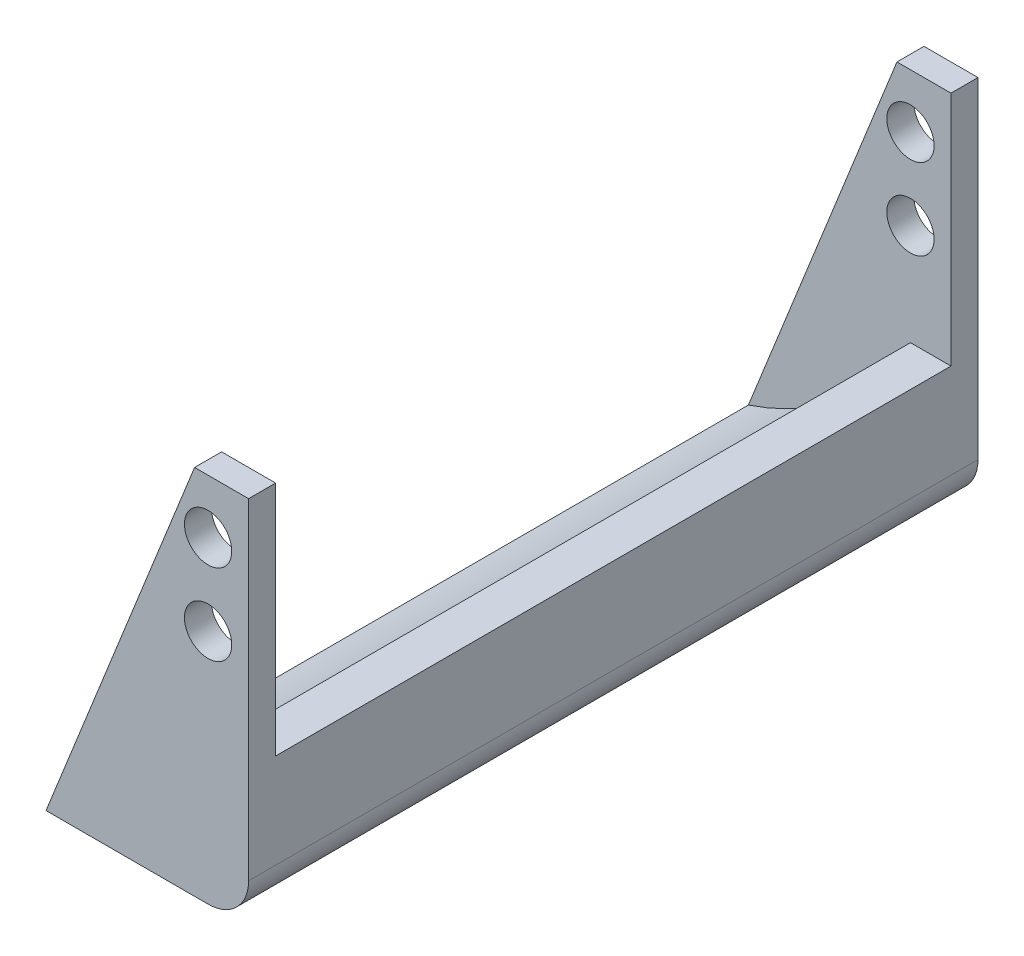
from build123d import *

# Parameters (mm, degrees)
BOSS_EXTRUDE1_DEPTH = 25
SKETCH2_R           = 1.75
BOSS_EXTRUDE2_DEPTH = 2
FILLET1_R           = 3


with BuildPart() as part:
    # Sketch1 → Boss-Extrude1 (new, symmetric)
    with BuildSketch(Plane.XY):
        with BuildLine():
            Line((0, 0), (15, 0))
            Line((15, 0), (15, 10))
            Line((15, 10), (12, 10))
            ThreePointArc((12, 10), (6.940286442, 3.871656269), (0, 0))
        make_face()
    extrude(amount=BOSS_EXTRUDE1_DEPTH, both=True)

    # Sketch2 → Boss-Extrude2 (add)
    with BuildSketch(Plane.XY.offset(25)):
        Polygon((15, 0), (15, 27.5), (11, 27.5), (0, 0), align=None)
        with Locations((12, 23.5)):
            Circle(SKETCH2_R, mode=Mode.SUBTRACT)
        with Locations((12, 17.5)):
            Circle(SKETCH2_R, mode=Mode.SUBTRACT)
    boss_extrude2 = extrude(amount=BOSS_EXTRUDE2_DEPTH)

    # Mirror1: Boss-Extrude2 across plane
    add(boss_extrude2.mirror(Plane.XY))

    # Fillet1
    fillet1_edges = [part.edges().sort_by_distance(p)[0] for p in [
        (15, 0, 0),
    ]]
    fillet(fillet1_edges, radius=FILLET1_R)


solid = part.part
